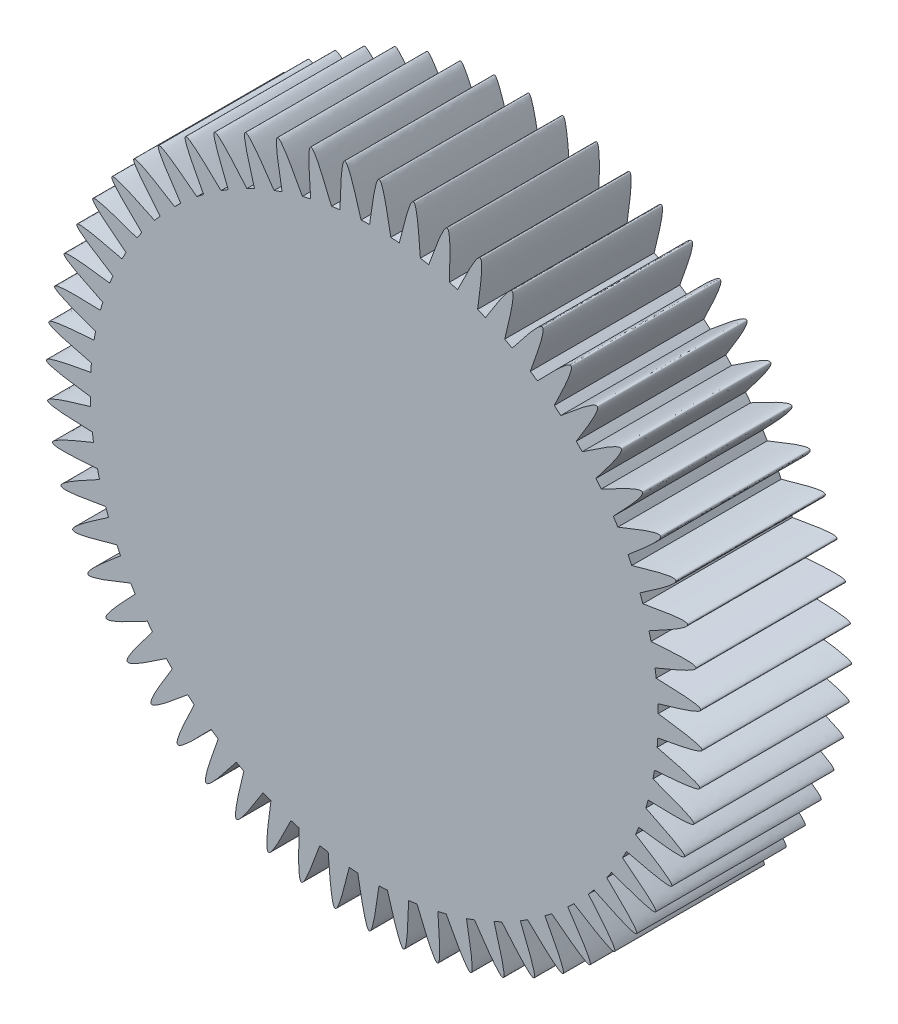
from build123d import *

# Parameters (mm, degrees)
SKETCH_1_R               = 19
EXTRUDE_1_DEPTH          = 10
EXTRUDE_START            = -10
EXTRUDE_2_DEPTH          = 10
PATTERN_CIRCULAR_1_COUNT = 60


with BuildPart() as part:
    # 스케치1 → 보스-돌출1 (new body)
    with BuildSketch(Plane.XY):
        Circle(SKETCH_1_R)
    extrude(amount=EXTRUDE_1_DEPTH)

    # 스케치2 → 보스-돌출2 (add)
    with BuildSketch(Plane.XY.offset(10).offset(EXTRUDE_START)):
        with BuildLine():
            add(Edge.make_bspline(
                [(-14.328258115, 12.478021454), (-15.278406812, 13.605516557), (-17.198574288, 15.884085621), (-14.644903332, 14.309943029), (-13.354855035, 13.514727041)],
                knots=[0, 0, 0, 0, 0.494825951, 1, 1, 1, 1], degree=3))
            ThreePointArc((-14.328258115, 12.478021454), (-13.851259078, 13.005484303), (-13.354855035, 13.514727041))
        make_face()
    extrude_2 = extrude(amount=EXTRUDE_2_DEPTH)

    # 원형 패턴1: 보스-돌출2 ×60 about axis
    pattern_circular_1_axis = Axis((0, 0, 10), (0, 0, -1))
    for i in range(1, PATTERN_CIRCULAR_1_COUNT):
        add(extrude_2.rotate(pattern_circular_1_axis, i * 360 / PATTERN_CIRCULAR_1_COUNT))


solid = part.part
